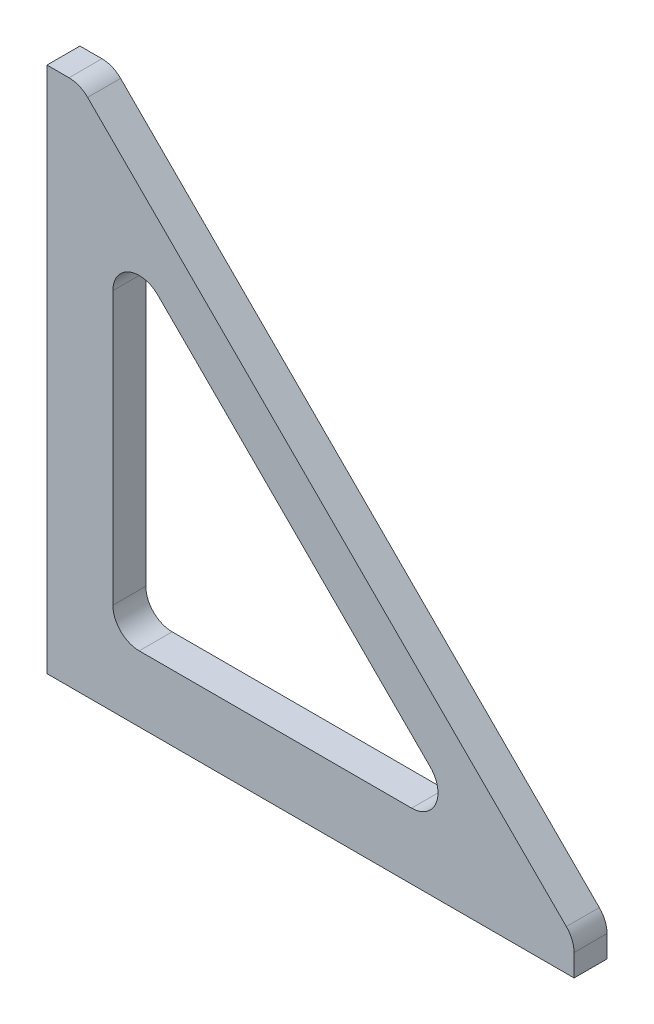
from build123d import *

# Parameters (mm, degrees)
BOSS_EXTRUDE1_DEPTH = 3.175
CUT_EXTRUDE1_DEPTH  = 3.175
FILLET4_R           = 2.54
FILLET5_R           = 2.54


with BuildPart() as part:
    # Sketch1 → Boss-Extrude1 (new body)
    with BuildSketch(Plane.XY):
        Polygon((0, 0), (0, 50.8), (3.175, 50.8), (50.8, 3.175), (50.8, 0), align=None)
    extrude(amount=BOSS_EXTRUDE1_DEPTH)

    # Sketch7 → Cut-Extrude1 (cut)
    with BuildSketch(Plane.XY.offset(3.175)):
        Polygon((6.35, 41.275), (6.35, 6.35), (41.275, 6.35), align=None)
    extrude(amount=-CUT_EXTRUDE1_DEPTH, mode=Mode.SUBTRACT)

    # Fillet4
    fillet4_edges = [part.edges().sort_by_distance(p)[0] for p in [
        (50.8, 3.175, 1.5875),
        (3.175, 50.8, 1.5875),
    ]]
    fillet(fillet4_edges, radius=FILLET4_R)

    # Fillet5
    fillet5_edges = [part.edges().sort_by_distance(p)[0] for p in [
        (6.35, 6.35, 1.5875),
        (41.275, 6.35, 1.5875),
        (6.35, 41.275, 1.5875),
    ]]
    fillet(fillet5_edges, radius=FILLET5_R)


solid = part.part
